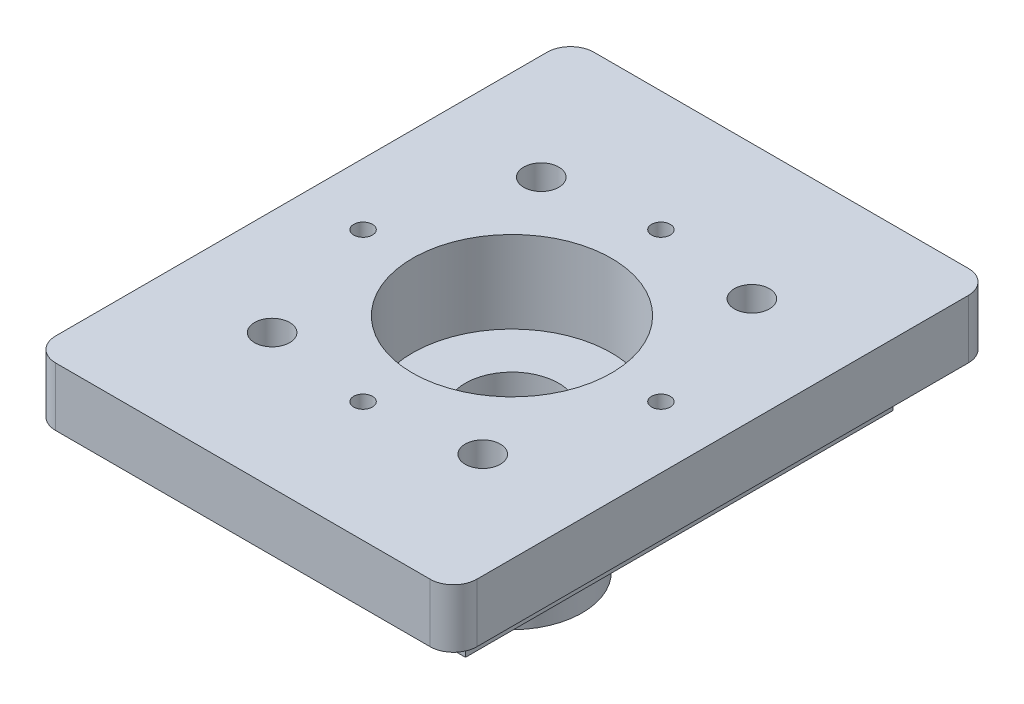
from build123d import *

# Parameters (mm, degrees)
SKETCH1_W           = 45.72
SKETCH1_H           = 58.42
BOSS_EXTRUDE1_DEPTH = 6.35
SKETCH2_R           = 1.905
CUT_EXTRUDE1_DEPTH  = 40.859352933
SKETCH3_W           = 36.327462092
SKETCH3_H           = 46.418423785
BOSS_EXTRUDE2_DEPTH = 5.08
SKETCH4_R           = 7.62
SKETCH4_R_2         = 5.08
BOSS_EXTRUDE3_DEPTH = 12.7
FILLET1_R           = 2.54
SKETCH5_R           = 10.795
CUT_EXTRUDE2_DEPTH  = 8.89
SKETCH6_R           = 1.016
CUT_EXTRUDE3_DEPTH  = 19.05
CUT_EXTRUDE4_START  = -19.05
SKETCH4_2_R         = 5.08
CUT_EXTRUDE4_DEPTH  = 19.05


with BuildPart() as part:
    # Sketch1 → Boss-Extrude1 (new body)
    with BuildSketch(Plane(origin=(0, 0, 0), x_dir=(1, 0, 0), z_dir=(0, 1, 0))):
        with Locations((2.874210526, -0.559043062)):
            Rectangle(SKETCH1_W, SKETCH1_H)
    extrude(amount=BOSS_EXTRUDE1_DEPTH)

    # Sketch2 → Cut-Extrude1 (cut, through all)
    with BuildSketch(Plane(origin=(0, 6.35, 0), x_dir=(1, 0, 0), z_dir=(0, 1, 0))):
        with Locations((-8.555789474, 14.045956938)):
            Circle(SKETCH2_R)
        with Locations((14.304210526, 14.045956938)):
            Circle(SKETCH2_R)
        with Locations((-8.555789474, -15.164043062)):
            Circle(SKETCH2_R)
        with Locations((14.304210526, -15.164043062)):
            Circle(SKETCH2_R)
    extrude(amount=-CUT_EXTRUDE1_DEPTH, mode=Mode.SUBTRACT)

    # Sketch3 → Boss-Extrude2 (add)
    with BuildSketch(Plane.XZ):
        with Locations((2.874210526, 0.559043062)):
            Rectangle(SKETCH3_W, SKETCH3_H)
    extrude(amount=BOSS_EXTRUDE2_DEPTH)

    # Sketch4 → Boss-Extrude3 (add)
    with BuildSketch(Plane.XZ.offset(5.08)):
        with Locations((2.874210526, 0.559043062)):
            Circle(SKETCH4_R)
        with Locations((2.874210526, 0.559043062)):
            Circle(SKETCH4_R_2, mode=Mode.SUBTRACT)
    extrude(amount=BOSS_EXTRUDE3_DEPTH)

    # Fillet1
    fillet1_edges = [part.edges().sort_by_distance(p)[0] for p in [
        (25.734210526, 3.175, -28.650956938),
        (-19.985789474, 3.175, -28.650956938),
        (-19.985789474, 3.175, 29.769043062),
        (25.734210526, 3.175, 29.769043062),
    ]]
    fillet(fillet1_edges, radius=FILLET1_R)

    # Sketch5 → Cut-Extrude2 (cut)
    with BuildSketch(Plane(origin=(0, 6.35, 0), x_dir=(1, 0, 0), z_dir=(0, 1, 0))):
        with Locations((2.874210526, -0.559043062)):
            Circle(SKETCH5_R)
    extrude(amount=-CUT_EXTRUDE2_DEPTH, mode=Mode.SUBTRACT)

    # Sketch6 → Cut-Extrude3 (cut)
    with BuildSketch(Plane(origin=(0, 6.35, 0), x_dir=(1, 0, 0), z_dir=(0, 1, 0))):
        with Locations((2.874210526, 15.605417956)):
            Circle(SKETCH6_R)
        with Locations((-13.290250492, -0.559043062)):
            Circle(SKETCH6_R)
        with Locations((2.874210526, -16.72350408)):
            Circle(SKETCH6_R)
        with Locations((19.038671544, -0.559043062)):
            Circle(SKETCH6_R)
    extrude(amount=-CUT_EXTRUDE3_DEPTH, mode=Mode.SUBTRACT)

    # Sketch4<2> → Cut-Extrude4 (cut)
    with BuildSketch(Plane.XZ.offset(5.08).offset(CUT_EXTRUDE4_START)):
        with Locations((2.874210526, 0.559043062)):
            Circle(SKETCH4_2_R)
    extrude(amount=CUT_EXTRUDE4_DEPTH, mode=Mode.SUBTRACT)


solid = part.part
